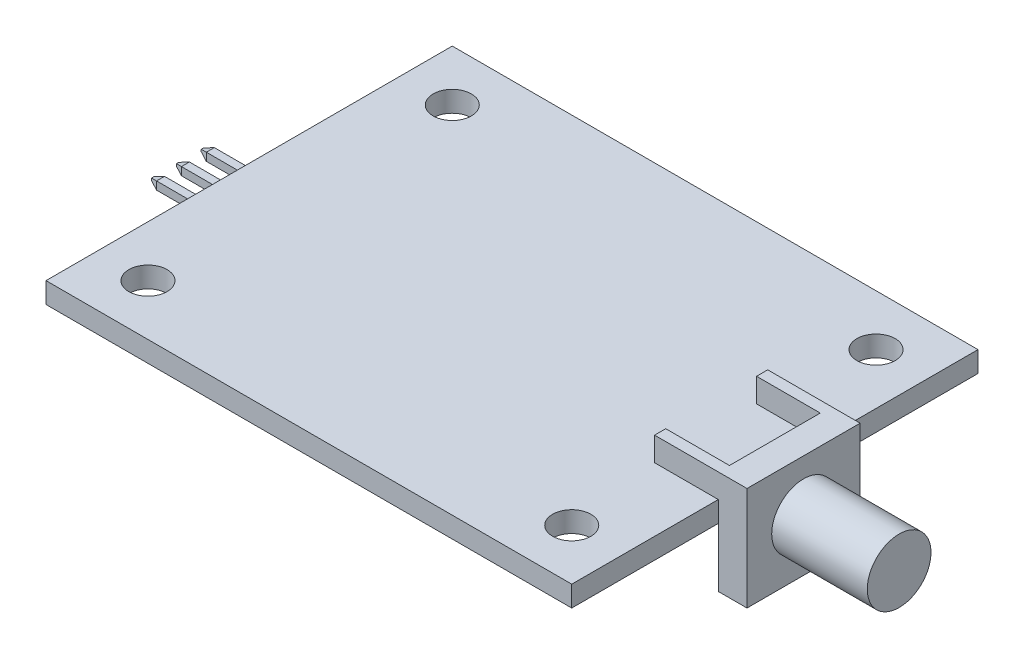
from build123d import *

# Parameters (mm, degrees)
SKETCH1_W                     = 41.91
SKETCH1_H                     = 32.385
BOSS_EXTRUDE1_DEPTH           = 1.651
SKETCH2_R                     = 1.524
CUT_EXTRUDE1_DEPTH            = 27.533655652
SKETCH3_W                     = 5.08
SKETCH3_H                     = 0.889
BOSS_EXTRUDE2_DEPTH           = 1.905
BOSS_EXTRUDE3_DEPTH           = 1.905
BOSS_EXTRUDE3_DEPTH_BACK      = 6.35
SKETCH4_W                     = 2.286
SKETCH4_H                     = 9.017
SKETCH5_R                     = 2.54
BOSS_EXTRUDE4_DEPTH           = 7.62
SKETCH6_W                     = 2.54
SKETCH6_H                     = 7.9375
BOSS_EXTRUDE5_DEPTH           = 2.54
SKETCH7_W                     = 0.635
SKETCH7_H                     = 0.635
BOSS_EXTRUDE6_DEPTH           = 7.62
SKETCH8_W                     = 0.635
SKETCH8_H                     = 0.635
BOSS_EXTRUDE7_DEPTH           = 0.635
BOSS_EXTRUDE7_DRAFT           = 20
BOSS_EXTRUDE7_PROFILE_2_DEPTH = 0.635
BOSS_EXTRUDE7_PROFILE_2_DRAFT = 20
BOSS_EXTRUDE7_PROFILE_3_DEPTH = 0.635
BOSS_EXTRUDE7_PROFILE_3_DRAFT = 20


with BuildPart() as part:
    # Sketch1 → Boss-Extrude1 (new body)
    with BuildSketch(Plane(origin=(0, 0, 0), x_dir=(1, 0, 0), z_dir=(0, 1, 0))):
        Rectangle(SKETCH1_W, SKETCH1_H)
    extrude(amount=BOSS_EXTRUDE1_DEPTH)

    # Sketch2 → Cut-Extrude1 (cut, through all)
    with BuildSketch(Plane(origin=(0, 1.651, 0), x_dir=(1, 0, 0), z_dir=(0, 1, 0))):
        with Locations(Location((-16.891, 12.1285, 0), (0, 0, 270))):
            Circle(SKETCH2_R)
        with Locations(Location((16.891, 12.1285, 0), (0, 0, 270))):
            Circle(SKETCH2_R)
        with Locations(Location((-16.891, -12.1285, 0), (0, 0, 270))):
            Circle(SKETCH2_R)
        with Locations(Location((16.891, -12.1285, 0), (0, 0, 270))):
            Circle(SKETCH2_R)
    extrude(amount=-CUT_EXTRUDE1_DEPTH, mode=Mode.SUBTRACT)

    # Sketch3 → Boss-Extrude2 (add)
    with BuildSketch(Plane(origin=(0, 1.651, 0), x_dir=(1, 0, 0), z_dir=(0, 1, 0))):
        with Locations((18.415, 4.064)):
            Rectangle(SKETCH3_W, SKETCH3_H)
        with Locations((18.415, -4.064)):
            Rectangle(SKETCH3_W, SKETCH3_H)
    extrude(amount=BOSS_EXTRUDE2_DEPTH)

    # Sketch4 → Boss-Extrude3 (add, two sides: drawn at the far end of the back side and taken through both)
    with BuildSketch(Plane(origin=(0, 1.651, 0), x_dir=(1, 0, 0), z_dir=(0, 1, 0)).offset(-BOSS_EXTRUDE3_DEPTH_BACK)):
        with Locations((22.098, 0)):
            Rectangle(SKETCH4_W, SKETCH4_H)
    extrude(amount=BOSS_EXTRUDE3_DEPTH + BOSS_EXTRUDE3_DEPTH_BACK)

    # Sketch5 → Boss-Extrude4 (add)
    with BuildSketch(Plane(origin=(23.241, 0, 0), x_dir=(0, 0, -1), z_dir=(1, 0, 0))):
        with Locations(Location((0, -0.5715, 0), (0, 0, 180))):
            Circle(SKETCH5_R)
    extrude(amount=BOSS_EXTRUDE4_DEPTH)

    # Sketch6 → Boss-Extrude5 (add)
    with BuildSketch(Plane.XZ):
        with Locations((-17.145, 0)):
            Rectangle(SKETCH6_W, SKETCH6_H)
    extrude(amount=BOSS_EXTRUDE5_DEPTH)

    # Sketch7 → Boss-Extrude6 (add)
    with BuildSketch(Plane.ZY.offset(18.415)):
        with Locations((1.984375, -1.27)):
            Rectangle(SKETCH7_W, SKETCH7_H)
        with Locations((0, -1.27)):
            Rectangle(SKETCH7_W, SKETCH7_H)
        with Locations((-1.984375, -1.27)):
            Rectangle(SKETCH7_W, SKETCH7_H)
    extrude(amount=BOSS_EXTRUDE6_DEPTH)


with BuildPart() as boss_extrude7_tool:
    # Sketch8 → Boss-Extrude7 (with draft: the straight prism first)
    with BuildSketch(Plane.ZY.offset(26.035)):
        with Locations((-1.984375, -1.27)):
            Rectangle(SKETCH8_W, SKETCH8_H)
    extrude(amount=BOSS_EXTRUDE7_DEPTH)
    # Boss-Extrude7: the draft: its side faces are tilted about the plane it starts from
    boss_extrude7_sides = [boss_extrude7_tool.faces().sort_by_distance(p)[0] for p in [
        (-26.3525, -1.27, -2.301875),
        (-26.3525, -1.5875, -1.984375),
        (-26.3525, -1.27, -1.666875),
        (-26.3525, -0.9525, -1.984375),
    ]]
    draft(boss_extrude7_sides, Plane.ZY.offset(26.035), BOSS_EXTRUDE7_DRAFT)


with BuildPart() as part_1:
    add(part.part)

    # Boss-Extrude7: add boss_extrude7_tool
    add(boss_extrude7_tool.part)


with BuildPart() as boss_extrude7_profile_2_tool:
    # Sketch8 → Boss-Extrude7 profile 2 (with draft: the straight prism first)
    with BuildSketch(Plane.ZY.offset(26.035)):
        with Locations((0, -1.27)):
            Rectangle(SKETCH8_W, SKETCH8_H)
    extrude(amount=BOSS_EXTRUDE7_PROFILE_2_DEPTH)
    # Boss-Extrude7 profile 2: the draft: its side faces are tilted about the plane it starts from
    boss_extrude7_profile_2_sides = [boss_extrude7_profile_2_tool.faces().sort_by_distance(p)[0] for p in [
        (-26.3525, -1.27, -0.3175),
        (-26.3525, -1.5875, 0),
        (-26.3525, -1.27, 0.3175),
        (-26.3525, -0.9525, 0),
    ]]
    draft(boss_extrude7_profile_2_sides, Plane.ZY.offset(26.035), BOSS_EXTRUDE7_PROFILE_2_DRAFT)


with BuildPart() as part_2:
    add(part_1.part)

    # Boss-Extrude7 profile 2: add boss_extrude7_profile_2_tool
    add(boss_extrude7_profile_2_tool.part)


with BuildPart() as boss_extrude7_profile_3_tool:
    # Sketch8 → Boss-Extrude7 profile 3 (with draft: the straight prism first)
    with BuildSketch(Plane.ZY.offset(26.035)):
        with Locations((1.984375, -1.27)):
            Rectangle(SKETCH8_W, SKETCH8_H)
    extrude(amount=BOSS_EXTRUDE7_PROFILE_3_DEPTH)
    # Boss-Extrude7 profile 3: the draft: its side faces are tilted about the plane it starts from
    boss_extrude7_profile_3_sides = [boss_extrude7_profile_3_tool.faces().sort_by_distance(p)[0] for p in [
        (-26.3525, -1.27, 1.666875),
        (-26.3525, -1.5875, 1.984375),
        (-26.3525, -1.27, 2.301875),
        (-26.3525, -0.9525, 1.984375),
    ]]
    draft(boss_extrude7_profile_3_sides, Plane.ZY.offset(26.035), BOSS_EXTRUDE7_PROFILE_3_DRAFT)


with BuildPart() as part_3:
    add(part_2.part)

    # Boss-Extrude7 profile 3: add boss_extrude7_profile_3_tool
    add(boss_extrude7_profile_3_tool.part)


solid = part_3.part
